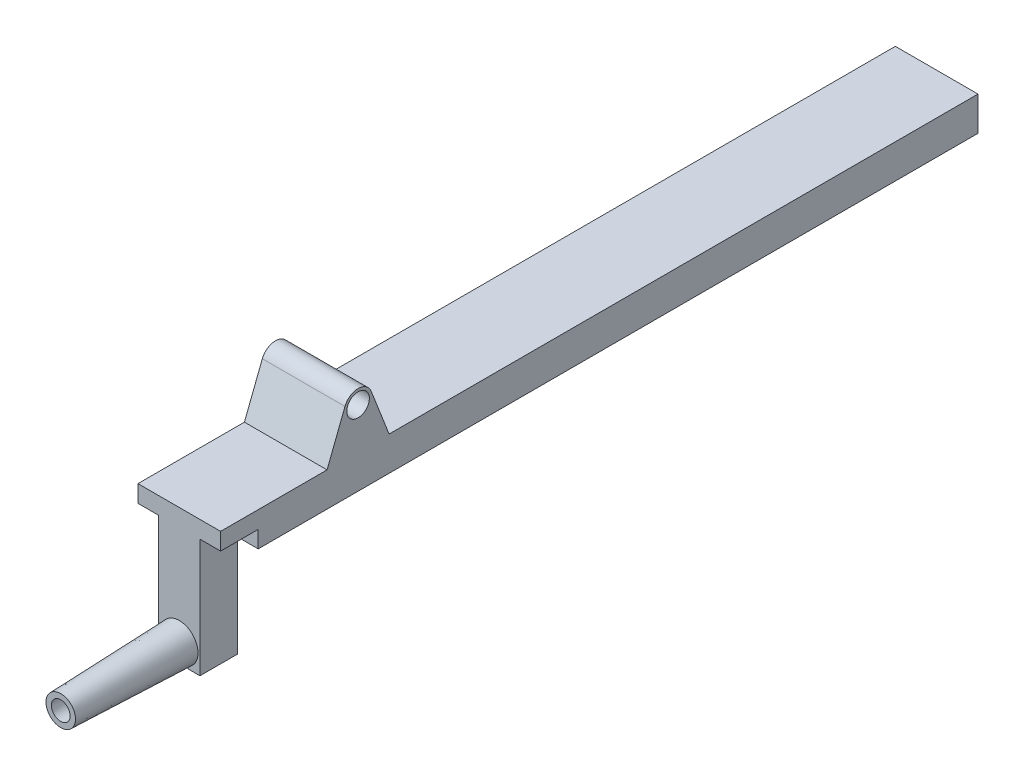
from build123d import *

# Parameters (mm, degrees)
BOSS_EXTRUDE2_DEPTH      = 27.94
BOSS_EXTRUDE2_DEPTH_BACK = 27.94
SKETCH3_R                = 7.62
SKETCH4_W                = 27.94
SKETCH4_H                = 25.4
BOSS_EXTRUDE3_DEPTH      = 80.01
CUT_EXTRUDE4_DEPTH       = 25.4
SKETCH9_R                = 9.9695
SKETCH10_R               = 12.7
SKETCH11_R               = 9.9695
SKETCH12_R               = 6.35
SKETCH14_W               = 55.88
SKETCH14_H               = 486.664
BOSS_EXTRUDE5_DEPTH      = 11.43


with BuildPart() as part:
    # Sketch3 → Boss-Extrude2 (new, two sides: drawn at the far end of the back side and taken through both)
    with BuildSketch(Plane(origin=(0, 0, 0), x_dir=(0, 0, -1), z_dir=(1, 0, 0)).offset(-BOSS_EXTRUDE2_DEPTH_BACK)):
        with BuildLine():
            Line((419.112, -27.6098), (28.956316714, -27.6098))
            Line((28.956316714, -27.6098), (20.9804, -27.6098))
            Line((20.9804, -27.6098), (8.875089173, 3.458094441))
            ThreePointArc((8.875089173, 3.458094441), (0, 9.525), (-8.875089173, 3.458094441))
            Line((-8.875089173, 3.458094441), (-20.9804, -27.6098))
            Line((-20.9804, -27.6098), (-28.958958547, -27.6098))
            Line((-28.958958547, -27.6098), (-92.952, -27.6098))
            Line((-92.952, -27.6098), (-92.952, -39.1795))
            Line((-92.952, -39.1795), (419.112, -39.1795))
            Line((419.112, -39.1795), (419.112, -27.6098))
        make_face()
        Circle(SKETCH3_R, mode=Mode.SUBTRACT)
    extrude(amount=BOSS_EXTRUDE2_DEPTH + BOSS_EXTRUDE2_DEPTH_BACK)

    # Sketch4 → Boss-Extrude3 (add)
    with BuildSketch(Plane.XZ.offset(39.1795)):
        with Locations((0, 80.252)):
            Rectangle(SKETCH4_W, SKETCH4_H)
    extrude(amount=BOSS_EXTRUDE3_DEPTH)

    # Sketch5 → Cut-Extrude4 (cut)
    with BuildSketch(Plane(origin=(0, 0, 67.552), x_dir=(-1, 0, 0), z_dir=(0, 0, -1))):
        with BuildLine():
            Line((6.02838635, -117.667539095), (6.02838635, -119.1895))
            Line((6.02838635, -119.1895), (0, -119.1895))
            ThreePointArc((0, -119.1895), (3.108770134, -118.803132618), (6.02838635, -117.667539095))
        make_face()
        with BuildLine():
            Line((0, -116.459), (0, -96.52))
            ThreePointArc((0, -96.52), (9.9695, -106.4895), (0, -116.459))
        make_face()
    cut_extrude4 = extrude(amount=-CUT_EXTRUDE4_DEPTH, mode=Mode.SUBTRACT)

    # Mirror1: Cut-Extrude4 across plane
    add(cut_extrude4.mirror(Plane(origin=(0, -116.459, 115.244479702), x_dir=(0, 0, 1), z_dir=(1, 0, 0))), mode=Mode.SUBTRACT)

    # Sketch9 → Loft1 section 0
    with BuildSketch(Plane.XY.offset(173.10039435)):
        with Locations((0, -106.4895)):
            Circle(SKETCH9_R)
    # Sketch10 → Loft1 section 1
    with BuildSketch(Plane.XY.offset(92.952)):
        with Locations((0, -106.4895)):
            Circle(SKETCH10_R)
    loft()

    # Sketch11 → Cut-Loft1 section 0
    with BuildSketch(Plane.XY.offset(92.952)):
        with Locations((0, -106.4895)):
            Circle(SKETCH11_R)
    # Sketch12 → Cut-Loft1 section 1
    with BuildSketch(Plane.XY.offset(173.10039435)):
        with Locations((0, -106.4895)):
            Circle(SKETCH12_R)
    loft(mode=Mode.SUBTRACT)

    # Sketch14 → Boss-Extrude5 (add)
    with BuildSketch(Plane.XZ.offset(39.1795)):
        with Locations((0, -175.78)):
            Rectangle(SKETCH14_W, SKETCH14_H)
    extrude(amount=BOSS_EXTRUDE5_DEPTH)


solid = part.part
